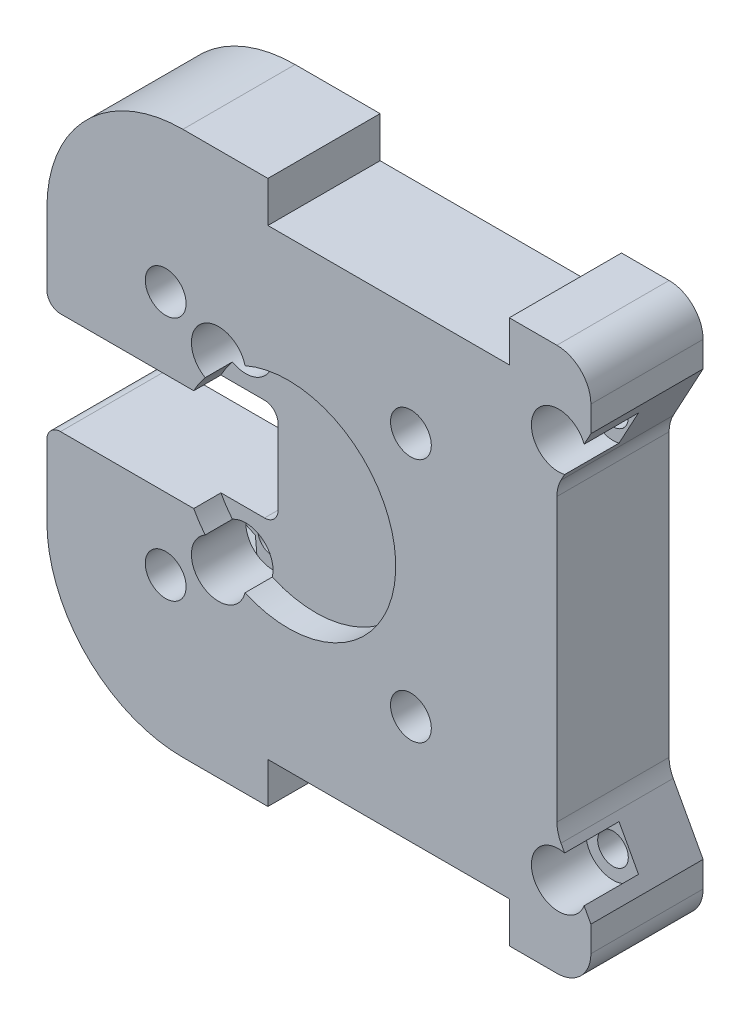
from build123d import *

# Parameters (mm, degrees)
SKETCH_1_W                = 80
SKETCH_1_H                = 80
EXTRUDE_1_DEPTH           = 16.5
FILLET_1_R                = 20
FILLET_2_R                = 5
SKETCH_2_W                = 30
SKETCH_2_H                = 15
CUT_EXTRUDE_1_DEPTH       = 72.127592652
FILLET_3_R                = 2
SKETCH_3_W                = 35.5
SKETCH_3_H                = 6
CUT_EXTRUDE_2_DEPTH       = 72.127592652
SKETCH_4_W                = 35.5
SKETCH_4_H                = 6
CUT_EXTRUDE_3_DEPTH       = 72.127592652
SKETCH_5_W                = 5
SKETCH_5_H                = 44
CUT_EXTRUDE_4_DEPTH       = 72.127592652
HOLE_WIZARD_3_D           = 4.5
HOLE_WIZARD_3_CBORE_D     = 8
HOLE_WIZARD_3_CBORE_DEPTH = 4.6
SKETCH_10_R               = 15.8
CUT_EXTRUDE_5_DEPTH       = 4
SKETCH_18_R               = 4
CUT_EXTRUDE_7_DEPTH       = 8
CUT_EXTRUDE_9_DEPTH       = 72.127592652
FILLET_4_R                = 5
SKETCH_11_R               = 3
CUT_EXTRUDE_10_DEPTH      = 72.127592652
CUT_EXTRUDE_11_DEPTH      = 8.5


with BuildPart() as part:
    # 草图1 → 凸台-拉伸1 (new body)
    with BuildSketch(Plane.XY):
        with Locations((3.759980536, -13.590563907)):
            Rectangle(SKETCH_1_W, SKETCH_1_H)
    extrude(amount=EXTRUDE_1_DEPTH)

    # 圆角1
    fillet_1_edges = [part.edges().sort_by_distance(p)[0] for p in [
        (-36.240019464, 26.409436093, 8.25),
        (-36.240019464, -53.590563907, 8.25),
    ]]
    fillet(fillet_1_edges, radius=FILLET_1_R)

    # 圆角2
    fillet_2_edges = [part.edges().sort_by_distance(p)[0] for p in [
        (43.759980536, 26.409436093, 8.25),
        (43.759980536, -53.590563907, 8.25),
    ]]
    fillet(fillet_2_edges, radius=FILLET_2_R)

    # 草图2 → 切除-拉伸1 (cut, through all)
    with BuildSketch(Plane(origin=(0, 0, 0), x_dir=(-1, 0, 0), z_dir=(0, 0, -1))):
        with Locations((21.240019464, -13.590563907)):
            Rectangle(SKETCH_2_W, SKETCH_2_H)
    extrude(amount=-CUT_EXTRUDE_1_DEPTH, mode=Mode.SUBTRACT)

    # 圆角3
    fillet_3_edges = [part.edges().sort_by_distance(p)[0] for p in [
        (-36.240019464, -6.090563907, 8.25),
        (-36.240019464, -21.090563907, 8.25),
        (-6.240019464, -21.090563907, 8.25),
        (-6.240019464, -6.090563907, 8.25),
    ]]
    fillet(fillet_3_edges, radius=FILLET_3_R)

    # 草图3 → 切除-拉伸2 (cut, through all)
    with BuildSketch(Plane.XY.offset(16.5)):
        with Locations((14.009980536, 23.409436093)):
            Rectangle(SKETCH_3_W, SKETCH_3_H)
    extrude(amount=-CUT_EXTRUDE_2_DEPTH, mode=Mode.SUBTRACT)

    # 草图4 → 切除-拉伸3 (cut, through all)
    with BuildSketch(Plane.XY.offset(16.5)):
        with Locations((14.009980536, -50.590563907)):
            Rectangle(SKETCH_4_W, SKETCH_4_H)
    extrude(amount=-CUT_EXTRUDE_3_DEPTH, mode=Mode.SUBTRACT)

    # 草图5 → 切除-拉伸4 (cut, through all)
    with BuildSketch(Plane.XY.offset(16.5)):
        with Locations((41.259980536, -13.590563907)):
            Rectangle(SKETCH_5_W, SKETCH_5_H)
    extrude(amount=-CUT_EXTRUDE_4_DEPTH, mode=Mode.SUBTRACT)

    # 打孔尺寸(%根据)内六角圆柱头螺钉的类型3 (through all)
    with Locations(Plane.XY.offset(16.5)):
        with Locations((-10.990019464, -0.090563907), (-10.990019464, -27.090563907), (39.009980536, 14.409436093), (39.009980536, -41.590563907)):
            CounterBoreHole(HOLE_WIZARD_3_D / 2, HOLE_WIZARD_3_CBORE_D / 2, HOLE_WIZARD_3_CBORE_DEPTH)

    # 草图10 → 切除-拉伸5 (cut)
    with BuildSketch(Plane.XY.offset(16.5)):
        with Locations((-0.740019464, -13.590563907)):
            Circle(SKETCH_10_R)
    extrude(amount=-CUT_EXTRUDE_5_DEPTH, mode=Mode.SUBTRACT)

    # 草图18 → 切除-拉伸7 (cut)
    with BuildSketch(Plane.XY.offset(16.5)):
        with Locations((-10.990019464, -0.090563907)):
            Circle(SKETCH_18_R)
        with Locations((-10.990019464, -27.090563907)):
            Circle(SKETCH_18_R)
        with Locations((39.009980536, -41.590563907)):
            Circle(SKETCH_18_R)
        with Locations((39.009980536, 14.409436093)):
            Circle(SKETCH_18_R)
    extrude(amount=-CUT_EXTRUDE_7_DEPTH, mode=Mode.SUBTRACT)

    # 草图21 → 切除-拉伸9 (cut, through all)
    with BuildSketch(Plane.XY.offset(16.5)):
        Polygon((38.759980536, 8.409436093), (43.759980536, 17.640880354), (43.759980536, 8.409436093), align=None)
        Polygon((43.759980536, -35.590563907), (38.759980536, -35.590563907), (43.759980536, -44.822008169), align=None)
    extrude(amount=-CUT_EXTRUDE_9_DEPTH, mode=Mode.SUBTRACT)

    # 圆角4
    fillet_4_edges = [part.edges().sort_by_distance(p)[0] for p in [
        (38.759980536, -35.590563907, 8.25),
        (38.759980536, 8.409436093, 8.25),
    ]]
    fillet(fillet_4_edges, radius=FILLET_4_R)

    # 草图11 → 切除-拉伸10 (cut, through all)
    with BuildSketch(Plane.XY.offset(16.5)):
        with Locations((-18.771242384, 4.440659013)):
            Circle(SKETCH_11_R)
        with Locations((17.291203456, 4.440659013)):
            Circle(SKETCH_11_R)
        with Locations((17.291203456, -31.621786828)):
            Circle(SKETCH_11_R)
        with Locations((-18.771242384, -31.621786828)):
            Circle(SKETCH_11_R)
    extrude(amount=-CUT_EXTRUDE_10_DEPTH, mode=Mode.SUBTRACT)

    # 草图22 → 切除-拉伸11 (cut)
    with BuildSketch(Plane(origin=(0, 0, 0), x_dir=(-1, 0, 0), z_dir=(0, 0, -1))):
        Polygon((-16.717600761, 10.765555319), (-22.481922986, 8.099861672), (-23.055525681, 1.774965366), (-17.864806152, -1.884237293), (-12.100483927, 0.781456354), (-11.526881231, 7.10635266), align=None)
        Polygon((-11.526881231, -28.956093181), (-16.717600761, -25.296890522), (-22.481922986, -27.962584169), (-23.055525681, -34.287480475), (-17.864806152, -37.946683134), (-12.100483927, -35.280989487), align=None)
        Polygon((24.535564609, 7.10635266), (19.34484508, 10.765555319), (13.580522855, 8.099861672), (13.006920159, 1.774965366), (18.197639689, -1.884237293), (23.961961914, 0.781456354), align=None)
        Polygon((18.197639689, -37.946683134), (23.961961914, -35.280989487), (24.535564609, -28.956093181), (19.34484508, -25.296890522), (13.580522855, -27.962584169), (13.006920159, -34.287480475), align=None)
    extrude(amount=-CUT_EXTRUDE_11_DEPTH, mode=Mode.SUBTRACT)


solid = part.part
